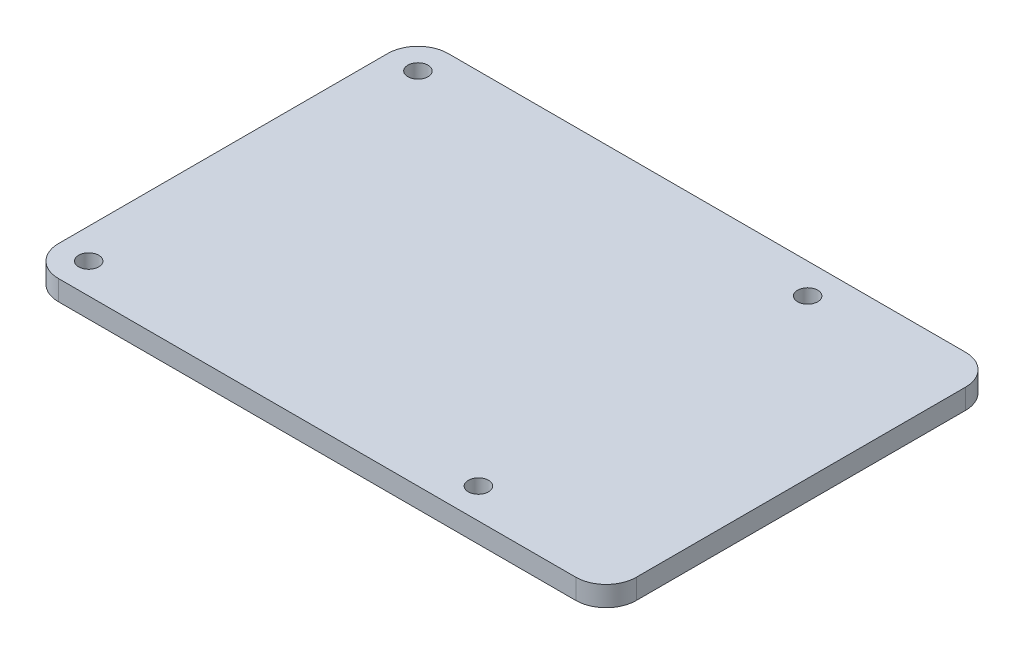
from build123d import *

# Parameters (mm, degrees)
SKETCH1_R           = 1.5
BOSS_EXTRUDE1_DEPTH = 3


with BuildPart() as part:
    # Sketch1 → Boss-Extrude1 (new body)
    with BuildSketch(Plane(origin=(0, 0, 0), x_dir=(1, 0, 0), z_dir=(0, 1, 0))):
        with BuildLine():
            Line((-42.076613259, -7.767232908), (-42.076613259, 41.232767092))
            ThreePointArc((-42.076613259, 41.232767092), (-40.758593774, 44.414747607), (-37.576613259, 45.732767092))
            Line((-37.576613259, 45.732767092), (39.423386741, 45.732767092))
            ThreePointArc((39.423386741, 45.732767092), (42.605367257, 44.414747607), (43.923386741, 41.232767092))
            Line((43.923386741, 41.232767092), (43.923386741, -7.767232908))
            ThreePointArc((43.923386741, -7.767232908), (42.605367257, -10.949213424), (39.423386741, -12.267232908))
            Line((39.423386741, -12.267232908), (-37.576613259, -12.267232908))
            ThreePointArc((-37.576613259, -12.267232908), (-40.758593774, -10.949213424), (-42.076613259, -7.767232908))
        make_face()
        with Locations(Location((-37.576613259, 41.232767092, 0), (0, 0, 270))):
            Circle(SKETCH1_R, mode=Mode.SUBTRACT)
        with Locations(Location((20.423386741, 41.232767092, 0), (0, 0, 270))):
            Circle(SKETCH1_R, mode=Mode.SUBTRACT)
        with Locations(Location((-37.576613259, -7.767232908, 0), (0, 0, 270))):
            Circle(SKETCH1_R, mode=Mode.SUBTRACT)
        with Locations(Location((20.423386741, -7.767232908, 0), (0, 0, 270))):
            Circle(SKETCH1_R, mode=Mode.SUBTRACT)
    extrude(amount=BOSS_EXTRUDE1_DEPTH)


solid = part.part
